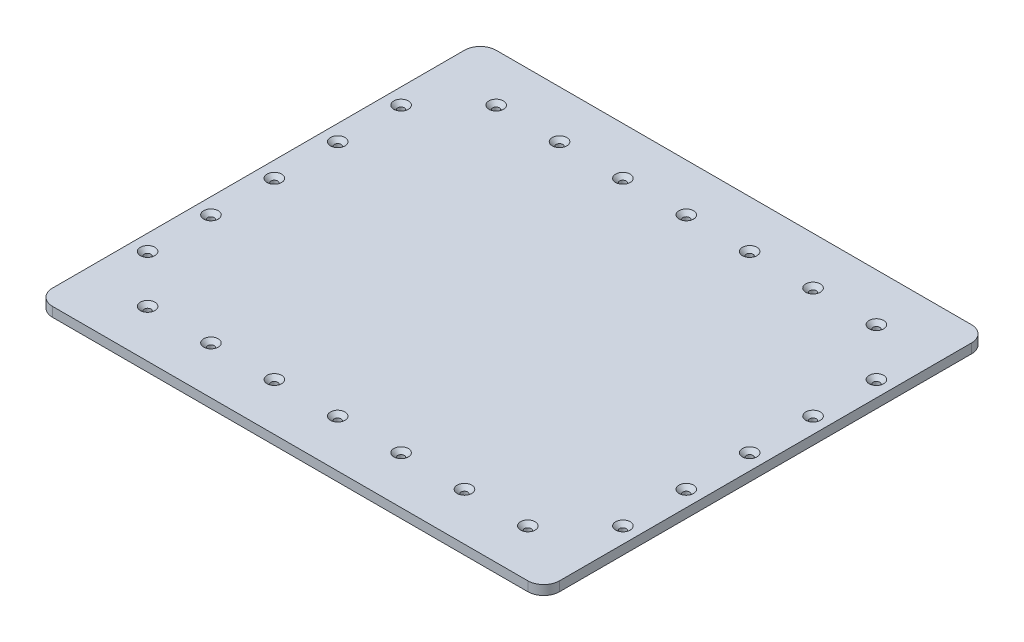
from build123d import *

# Parameters (mm, degrees)
EXTRUDE_1_DEPTH     = 3
SKETCH_5_R          = 2.1
CUT_EXTRUDE_4_DEPTH = 240
CHAMFER_2_SIZE      = 2.5


with BuildPart() as part:
    # 草图1 → 凸台-拉伸1 (new, symmetric)
    with BuildSketch(Plane(origin=(0, 0, 0), x_dir=(1, 0, 0), z_dir=(0, 1, 0))):
        with BuildLine():
            Line((-150, -140), (150, -140))
            ThreePointArc((150, -140), (157.071067812, -137.071067812), (160, -130))
            Line((160, -130), (160, 130))
            ThreePointArc((160, 130), (157.071067812, 137.071067812), (150, 140))
            Line((150, 140), (-150, 140))
            ThreePointArc((-150, 140), (-157.071067812, 137.071067812), (-160, 130))
            Line((-160, 130), (-160, -130))
            ThreePointArc((-160, -130), (-157.071067812, -137.071067812), (-150, -140))
        make_face()
    extrude(amount=EXTRUDE_1_DEPTH, both=True)

    # 草图5 → 切除-拉伸4 (cut)
    with BuildSketch(Plane(origin=(0, 3, 0), x_dir=(1, 0, 0), z_dir=(0, 1, 0))):
        with Locations(Location((0, 110, 0), (0, 0, 270))):
            Circle(SKETCH_5_R)
        with Locations(Location((40, 110, 0), (0, 0, 270))):
            Circle(SKETCH_5_R)
        with Locations(Location((80, 110, 0), (0, 0, 270))):
            Circle(SKETCH_5_R)
        with Locations(Location((120, 110, 0), (0, 0, 270))):
            Circle(SKETCH_5_R)
        with Locations(Location((-120, 110, 0), (0, 0, 270))):
            Circle(SKETCH_5_R)
        with Locations(Location((-80, 110, 0), (0, 0, 270))):
            Circle(SKETCH_5_R)
        with Locations(Location((-40, 110, 0), (0, 0, 270))):
            Circle(SKETCH_5_R)
        with Locations(Location((-40, -110, 0), (0, 0, 270))):
            Circle(SKETCH_5_R)
        with Locations(Location((-80, -110, 0), (0, 0, 270))):
            Circle(SKETCH_5_R)
        with Locations(Location((-120, -110, 0), (0, 0, 270))):
            Circle(SKETCH_5_R)
        with Locations(Location((120, -110, 0), (0, 0, 270))):
            Circle(SKETCH_5_R)
        with Locations(Location((80, -110, 0), (0, 0, 270))):
            Circle(SKETCH_5_R)
        with Locations(Location((40, -110, 0), (0, 0, 270))):
            Circle(SKETCH_5_R)
        with Locations(Location((0, -110, 0), (0, 0, 270))):
            Circle(SKETCH_5_R)
        with Locations(Location((-150, 0, 0), (0, 0, 270))):
            Circle(SKETCH_5_R)
        with Locations(Location((-150, -40, 0), (0, 0, 270))):
            Circle(SKETCH_5_R)
        with Locations(Location((-150, -80, 0), (0, 0, 270))):
            Circle(SKETCH_5_R)
        with Locations(Location((-150, 80, 0), (0, 0, 270))):
            Circle(SKETCH_5_R)
        with Locations(Location((-150, 40, 0), (0, 0, 270))):
            Circle(SKETCH_5_R)
        with Locations(Location((150, 40, 0), (0, 0, 270))):
            Circle(SKETCH_5_R)
        with Locations(Location((150, 80, 0), (0, 0, 270))):
            Circle(SKETCH_5_R)
        with Locations(Location((150, -80, 0), (0, 0, 270))):
            Circle(SKETCH_5_R)
        with Locations(Location((150, -40, 0), (0, 0, 270))):
            Circle(SKETCH_5_R)
        with Locations(Location((150, 0, 0), (0, 0, 270))):
            Circle(SKETCH_5_R)
    extrude(amount=-CUT_EXTRUDE_4_DEPTH, mode=Mode.SUBTRACT)

    # 倒角2
    chamfer_2_edges = [part.edges().sort_by_distance(p)[0] for p in [
        (-80, 3, -112.1),
        (-40, 3, -112.1),
        (-40, 3, 107.9),
        (-150, 3, -82.1),
        (-150, 3, -42.1),
        (150, 3, -42.1),
        (150, 3, -82.1),
        (150, 3, 77.9),
        (150, 3, 37.9),
        (150, 3, -2.1),
        (0, 3, -112.1),
        (-80, 3, 107.9),
        (-120, 3, 107.9),
        (120, 3, 107.9),
        (80, 3, 107.9),
        (40, 3, 107.9),
        (0, 3, 107.9),
        (-150, 3, 37.9),
        (-150, 3, 77.9),
        (-150, 3, -2.1),
        (120, 3, -112.1),
        (80, 3, -112.1),
        (40, 3, -112.1),
        (-120, 3, -112.1),
    ]]
    chamfer(chamfer_2_edges, length=CHAMFER_2_SIZE)


solid = part.part
